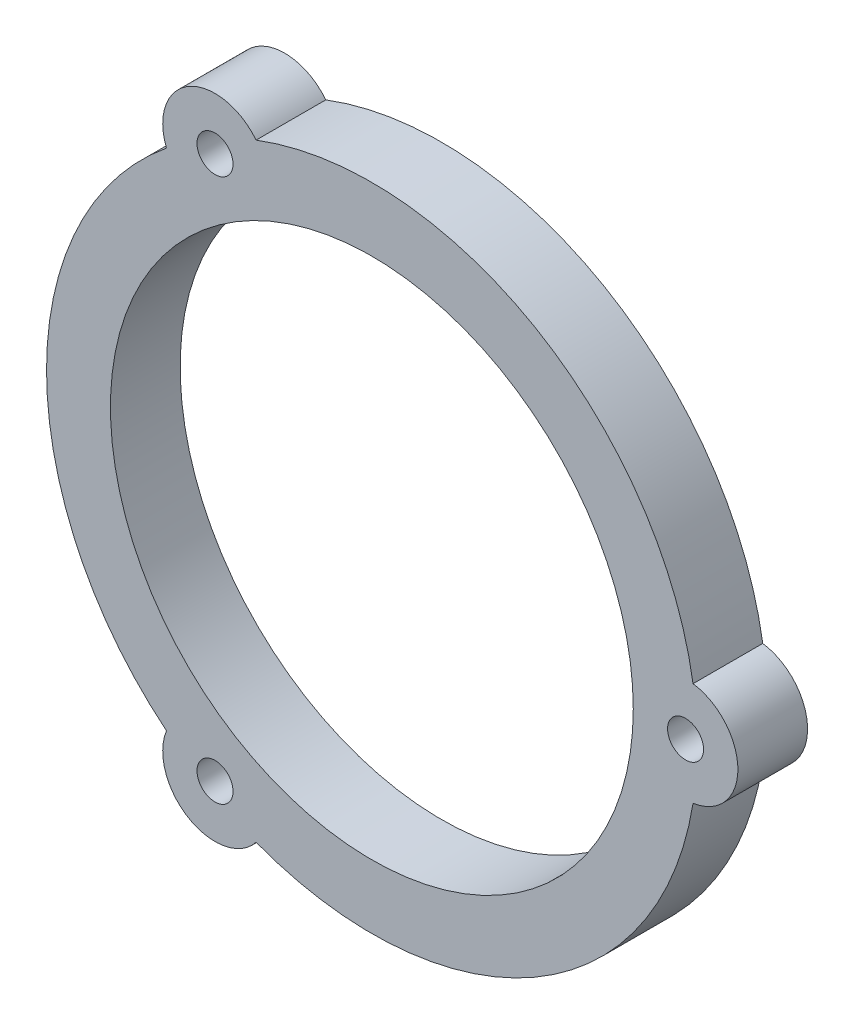
from build123d import *

# Parameters (mm, degrees)
SZKIC1_R                    = 28
DODANIE_WYCI_GNI_CIE1_DEPTH = 6
SZKIC3_R                    = 22.5
WYTNIJ_WYCI_GNI_CIE1_DEPTH  = 6
SZKIC5_R                    = 4.5
DODANIE_WYCI_GNI_CIE2_DEPTH = 6
SZKIC6_R                    = 1.55
WYTNIJ_WYCI_GNI_CIE2_DEPTH  = 6


with BuildPart() as part:
    # Szkic1 → Dodanie-wyciągnięcie1 (new body)
    with BuildSketch(Plane.XY):
        with Locations((51.52186297, 19.852107637)):
            Circle(SZKIC1_R)
    extrude(amount=DODANIE_WYCI_GNI_CIE1_DEPTH)

    # Szkic3 → Wytnij-wyciągnięcie1 (cut)
    with BuildSketch(Plane.XY.offset(6)):
        with Locations((51.52186297, 19.852107637)):
            Circle(SZKIC3_R)
    extrude(amount=-WYTNIJ_WYCI_GNI_CIE1_DEPTH, mode=Mode.SUBTRACT)

    # Szkic5 → Dodanie-wyciągnięcie2 (add)
    with BuildSketch(Plane.XY.offset(6)):
        with Locations((78.52186297, 19.852107638)):
            Circle(SZKIC5_R)
        with Locations((38.02186297, -3.530578265)):
            Circle(SZKIC5_R)
        with Locations((38.02186297, 43.23479354)):
            Circle(SZKIC5_R)
    extrude(amount=-DODANIE_WYCI_GNI_CIE2_DEPTH)

    # Szkic6 → Wytnij-wyciągnięcie2 (cut)
    with BuildSketch(Plane.XY.offset(6)):
        with Locations((78.52186297, 19.852107638)):
            Circle(SZKIC6_R)
        with Locations((38.02186297, -3.530578265)):
            Circle(SZKIC6_R)
        with Locations((38.02186297, 43.23479354)):
            Circle(SZKIC6_R)
    extrude(amount=-WYTNIJ_WYCI_GNI_CIE2_DEPTH, mode=Mode.SUBTRACT)


solid = part.part
